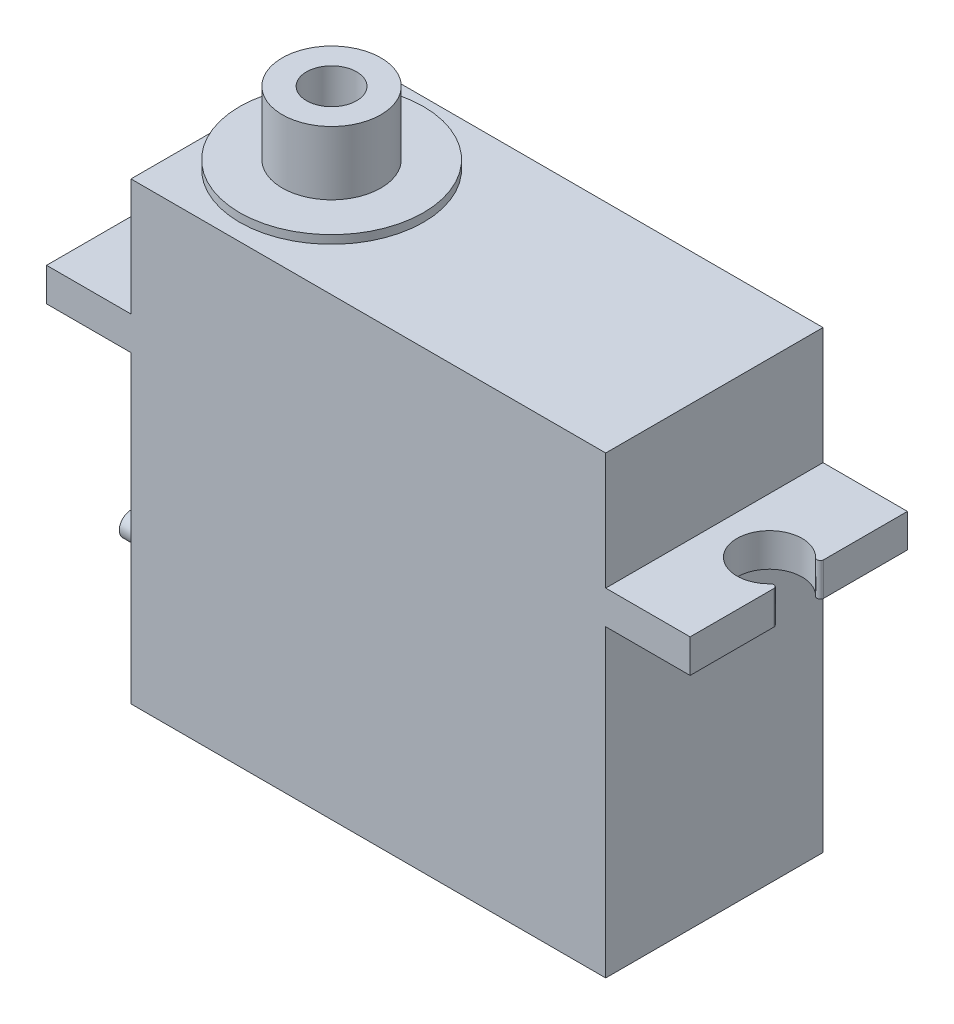
from build123d import *

# Parameters (mm, degrees)
ESQUISSE1_W                       = 28.4
ESQUISSE1_H                       = 27.2
ESQUISSE1_W_2                     = 5.05
ESQUISSE1_H_2                     = 2
BOSS_EXTRU_1_DEPTH                = 6.5
DIAM_TRE_DU_PER_AGE_3_9_3_9_1_D   = 3.9
CONG_1_R                          = 0.2
ESQUISSE6_R                       = 5.5
BOSS_EXTRU_4_DEPTH                = 0.5
ESQUISSE4_R                       = 2.95
BOSS_EXTRU_2_DEPTH                = 3.8
DIAM_TRE_DU_PER_AGE_3_0_3_1_D     = 3
DIAM_TRE_DU_PER_AGE_3_0_3_1_DEPTH = 6
DIAM_TRE_DU_PER_AGE_3_0_3_1_TIP   = 0.901290929
ESQUISSE8_W                       = 6.2
ESQUISSE8_H                       = 3.7
BOSS_EXTRU_5_DEPTH                = 3
ESQUISSE9_R                       = 0.7
BOSS_EXTRU_6_DEPTH                = 2


with BuildPart() as part:
    # Esquisse1 → Boss.-Extru.1 (new, symmetric)
    with BuildSketch(Plane.XY):
        with Locations((0, -4.6)):
            Rectangle(ESQUISSE1_W, ESQUISSE1_H)
        with Locations((-16.725, 1)):
            Rectangle(ESQUISSE1_W_2, ESQUISSE1_H_2)
        with Locations((16.725, 1)):
            Rectangle(ESQUISSE1_W_2, ESQUISSE1_H_2)
    extrude(amount=BOSS_EXTRU_1_DEPTH, both=True)

    # Diamètre du perçage Ø3.9 (3.9)1 (through all)
    with Locations(Plane(origin=(0, 2, 0), x_dir=(1, 0, 0), z_dir=(0, 1, 0))):
        with Locations((-17.5, 0), (17.5, 0)):
            Hole(DIAM_TRE_DU_PER_AGE_3_9_3_9_1_D / 2)

    # Congé1
    cong_1_edges = [part.edges().sort_by_distance(p)[0] for p in [
        (19.25, 1, -0.860232527),
        (19.25, 1, 0.860232527),
        (-19.25, 1, -0.860232527),
        (-19.25, 1, 0.860232527),
    ]]
    fillet(cong_1_edges, radius=CONG_1_R)

    # Esquisse6 → Boss.-Extru.4 (add)
    with BuildSketch(Plane(origin=(0, 9, 0), x_dir=(1, 0, 0), z_dir=(0, 1, 0))):
        with Locations(Location((-8.7, 0, 0), (0, 0, 180))):
            Circle(ESQUISSE6_R)
    extrude(amount=BOSS_EXTRU_4_DEPTH)

    # Esquisse4 → Boss.-Extru.2 (add)
    with BuildSketch(Plane(origin=(0, 9.5, 0), x_dir=(1, 0, 0), z_dir=(0, 1, 0))):
        with Locations((-8.7, 0)):
            Circle(ESQUISSE4_R)
    extrude(amount=BOSS_EXTRU_2_DEPTH)

    # Diamètre du perçage Ø3.0 (3)1
    with Locations(Plane(origin=(0, 13.3, 0), x_dir=(1, 0, 0), z_dir=(0, 1, 0))):
        with Locations((-8.7, 0)):
            Hole(DIAM_TRE_DU_PER_AGE_3_0_3_1_D / 2, depth=DIAM_TRE_DU_PER_AGE_3_0_3_1_DEPTH)
            with Locations((0, 0, -(DIAM_TRE_DU_PER_AGE_3_0_3_1_DEPTH + DIAM_TRE_DU_PER_AGE_3_0_3_1_TIP / 2))):  # 118° drill point
                Cone(0, DIAM_TRE_DU_PER_AGE_3_0_3_1_D / 2, DIAM_TRE_DU_PER_AGE_3_0_3_1_TIP, mode=Mode.SUBTRACT)

    # Esquisse8 → Boss.-Extru.5 (add)
    with BuildSketch(Plane.ZY.offset(14.2)):
        with Locations((0, -13.85)):
            Rectangle(ESQUISSE8_W, ESQUISSE8_H)
    extrude(amount=BOSS_EXTRU_5_DEPTH)

    # Esquisse9 → Boss.-Extru.6 (add)
    with BuildSketch(Plane.ZY.offset(17.2)):
        with Locations((0, -13.85)):
            Circle(ESQUISSE9_R)
        with Locations((-1.5, -13.85)):
            Circle(ESQUISSE9_R)
        with Locations(Location((1.5, -13.85, 0), (0, 0, 180))):
            Circle(ESQUISSE9_R)
    extrude(amount=BOSS_EXTRU_6_DEPTH)


solid = part.part
